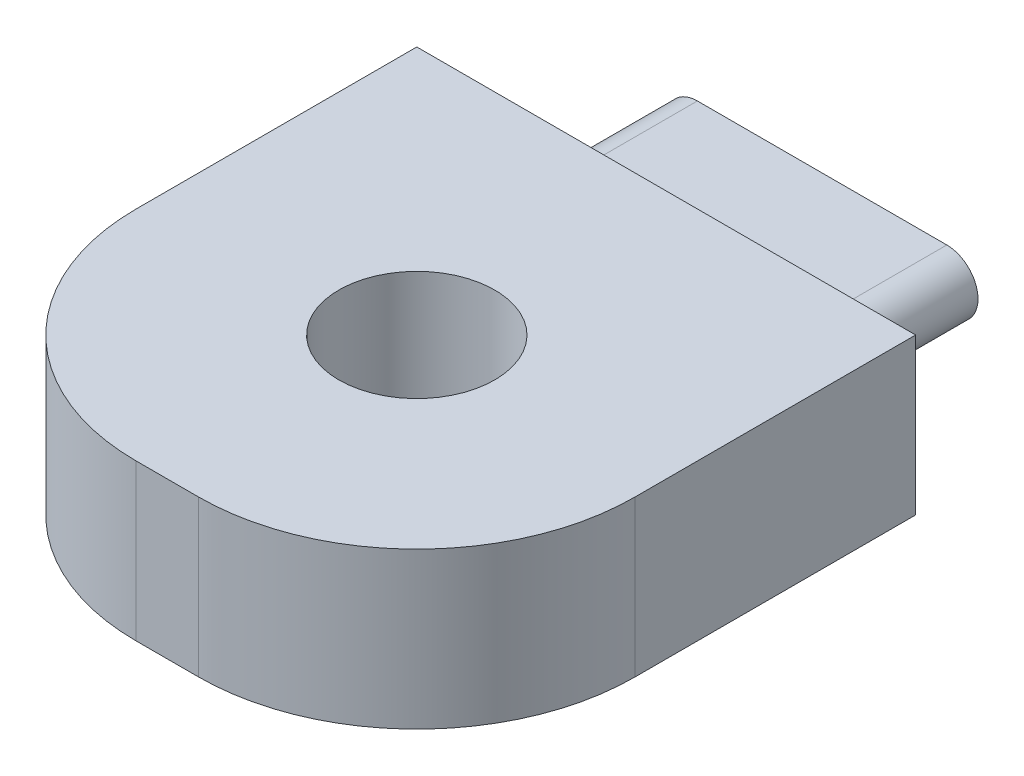
from build123d import *

# Parameters (mm, degrees)
SKETCH1_R           = 2.5
BOSS_EXTRUDE1_DEPTH = 5
BOSS_EXTRUDE2_DEPTH = 5


with BuildPart() as part:
    # Sketch1 → Boss-Extrude1 (new body)
    with BuildSketch(Plane(origin=(0, 0, 0), x_dir=(1, 0, 0), z_dir=(0, 1, 0))):
        with BuildLine():
            Line((-8, 0), (-8, -9))
            ThreePointArc((-8, -9), (-5.949747468, -13.949747468), (-1, -16))
            Line((-1, -16), (1, -16))
            ThreePointArc((1, -16), (5.949747468, -13.949747468), (8, -9))
            Line((8, -9), (8, 0))
            Line((8, 0), (-8, 0))
        make_face()
        with Locations(Location((0, -8, 0), (0, 0, 270))):
            Circle(SKETCH1_R, mode=Mode.SUBTRACT)
    extrude(amount=BOSS_EXTRUDE1_DEPTH)

    # Sketch2 → Boss-Extrude2 (add)
    with BuildSketch(Plane(origin=(0, 0, 0), x_dir=(-1, 0, 0), z_dir=(0, 0, -1))):
        with BuildLine():
            Line((-4, 3), (4, 3))
            ThreePointArc((4, 3), (5, 2), (4, 1))
            Line((4, 1), (-4, 1))
            ThreePointArc((-4, 1), (-5, 2), (-4, 3))
        make_face()
    extrude(amount=BOSS_EXTRUDE2_DEPTH)


solid = part.part
